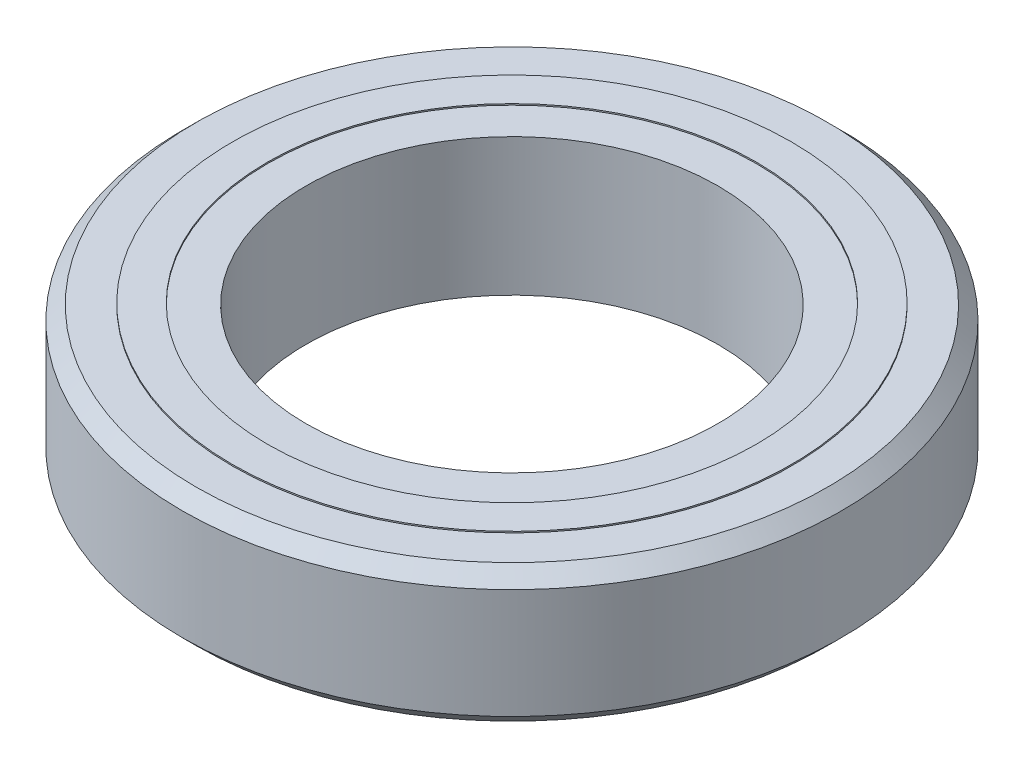
from build123d import *

# Parameters (mm, degrees)
CROQUIS1_R              = 12
CROQUIS1_R_2            = 7.5
SALIENTE_EXTRUIR1_DEPTH = 2.5
CHAFL_N1_SIZE           = 0.5
CROQUIS2_R              = 10.17563205
CROQUIS2_R_2            = 8.900263432
SALIENTE_EXTRUIR2_DEPTH = 2.55


with BuildPart() as part:
    # Croquis1 → Saliente-Extruir1 (new, symmetric)
    with BuildSketch(Plane(origin=(0, 0, 0), x_dir=(1, 0, 0), z_dir=(0, 1, 0))):
        with Locations(Location((0, 0, 0), (0, 0, 270))):
            Circle(CROQUIS1_R)
        with Locations(Location((0, 0, 0), (0, 0, 270))):
            Circle(CROQUIS1_R_2, mode=Mode.SUBTRACT)
    extrude(amount=SALIENTE_EXTRUIR1_DEPTH, both=True)

    # Chaflán1
    chafl_n1_edges = [part.edges().sort_by_distance(p)[0] for p in [
        (0, -2.5, -12),
        (0, 2.5, -12),
    ]]
    chamfer(chafl_n1_edges, length=CHAFL_N1_SIZE)

    # Croquis2 → Saliente-Extruir2 (add, symmetric)
    with BuildSketch(Plane(origin=(0, 0, 0), x_dir=(1, 0, 0), z_dir=(0, 1, 0))):
        with Locations(Location((0, 0, 0), (0, 0, 270))):
            Circle(CROQUIS2_R)
        with Locations(Location((0, 0, 0), (0, 0, 270))):
            Circle(CROQUIS2_R_2, mode=Mode.SUBTRACT)
    extrude(amount=SALIENTE_EXTRUIR2_DEPTH, both=True)


solid = part.part
